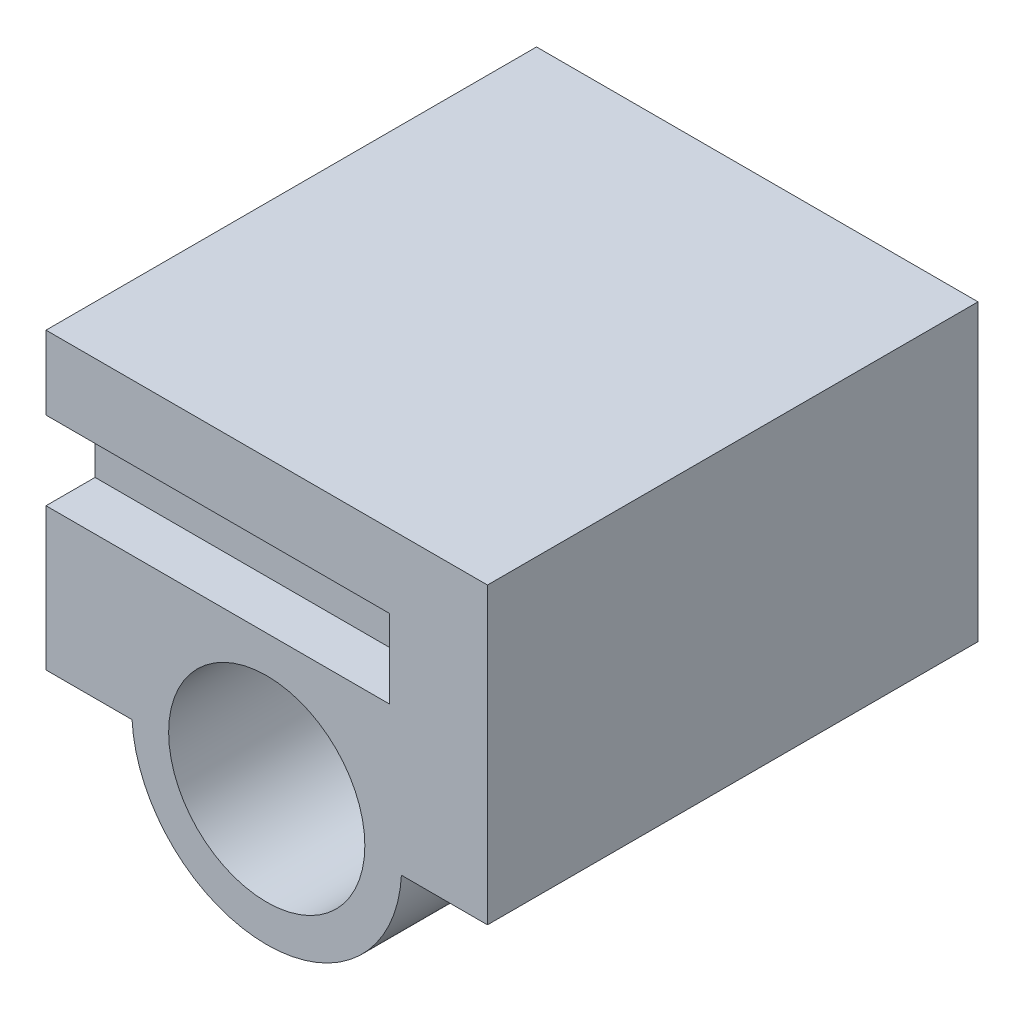
from build123d import *

# Parameters (mm, degrees)
SKETCH1_W           = 9
SKETCH1_H           = 6
BOSS_EXTRUDE1_DEPTH = 10
CUT_EXTRUDE1_START  = -2
SKETCH2_W           = 10
SKETCH2_H           = 1.6
CUT_EXTRUDE1_DEPTH  = 7
SKETCH3_R           = 2.75
BOSS_EXTRUDE2_DEPTH = 10
SKETCH4_R           = 2
CUT_EXTRUDE2_DEPTH  = 7
BOSS_EXTRUDE3_REACH = 16.573


with BuildPart() as part:
    # Sketch1 → Boss-Extrude1 (new body)
    with BuildSketch(Plane.XY):
        Rectangle(SKETCH1_W, SKETCH1_H)
    extrude(amount=BOSS_EXTRUDE1_DEPTH)

    # Sketch2 → Cut-Extrude1 (cut)
    with BuildSketch(Plane(origin=(4.5, 0, 0), x_dir=(0, 0, -1), z_dir=(1, 0, 0)).offset(CUT_EXTRUDE1_START)):
        with Locations((-5, 0.7)):
            Rectangle(SKETCH2_W, SKETCH2_H)
    extrude(amount=-CUT_EXTRUDE1_DEPTH, mode=Mode.SUBTRACT)

    # Sketch3 → Boss-Extrude2 (add, through all)
    with BuildSketch(Plane.XY.offset(10)):
        with Locations((0, -2.85)):
            Circle(SKETCH3_R)
    extrude(amount=-BOSS_EXTRUDE2_DEPTH)

    # Sketch4 → Cut-Extrude2 (cut)
    with BuildSketch(Plane.XY.offset(10)):
        with Locations((0, -2.85)):
            Circle(SKETCH4_R)
    extrude(amount=-CUT_EXTRUDE2_DEPTH, mode=Mode.SUBTRACT)

    # Sketch5 → Boss-Extrude3 (add, up to next)
    with BuildSketch(Plane.ZY.offset(4.5), mode=Mode.PRIVATE) as boss_extrude3_sk1:
        with BuildLine():
            Line((0, -0.1), (1, -0.1))
            Line((1, -0.1), (1, 0.65))
            ThreePointArc((1, 0.65), (0.956066017, 0.756066017), (0.85, 0.8))
            Line((0.85, 0.8), (0.15, 0.8))
            ThreePointArc((0.15, 0.8), (0.043933983, 0.756066017), (0, 0.65))
            Line((0, 0.65), (0, -0.1))
        make_face()
    boss_extrude3_tool1 = extrude(boss_extrude3_sk1.sketch, amount=-BOSS_EXTRUDE3_REACH, mode=Mode.PRIVATE) - part.part
    # Sketch5 → Boss-Extrude3 (add, up to next)
    with BuildSketch(Plane.ZY.offset(4.5), mode=Mode.PRIVATE) as boss_extrude3_sk2:
        with BuildLine():
            Line((2, -0.1), (2, 0.65))
            ThreePointArc((2, 0.65), (2.043933983, 0.756066017), (2.15, 0.8))
            Line((2.15, 0.8), (2.85, 0.8))
            ThreePointArc((2.85, 0.8), (2.956066017, 0.756066017), (3, 0.65))
            Line((3, 0.65), (3, -0.1))
            Line((3, -0.1), (2, -0.1))
        make_face()
    boss_extrude3_tool2 = extrude(boss_extrude3_sk2.sketch, amount=-BOSS_EXTRUDE3_REACH, mode=Mode.PRIVATE) - part.part
    # Sketch5 → Boss-Extrude3 (add, up to next)
    with BuildSketch(Plane.ZY.offset(4.5), mode=Mode.PRIVATE) as boss_extrude3_sk3:
        with BuildLine():
            Line((4, -0.1), (4, 0.65))
            ThreePointArc((4, 0.65), (4.043933983, 0.756066017), (4.15, 0.8))
            Line((4.15, 0.8), (4.85, 0.8))
            ThreePointArc((4.85, 0.8), (4.956066017, 0.756066017), (5, 0.65))
            Line((5, 0.65), (5, -0.1))
            Line((5, -0.1), (4, -0.1))
        make_face()
    boss_extrude3_tool3 = extrude(boss_extrude3_sk3.sketch, amount=-BOSS_EXTRUDE3_REACH, mode=Mode.PRIVATE) - part.part
    # Sketch5 → Boss-Extrude3 (add, up to next)
    with BuildSketch(Plane.ZY.offset(4.5), mode=Mode.PRIVATE) as boss_extrude3_sk4:
        with BuildLine():
            Line((6, -0.1), (6, 0.65))
            ThreePointArc((6, 0.65), (6.043933983, 0.756066017), (6.15, 0.8))
            Line((6.15, 0.8), (6.85, 0.8))
            ThreePointArc((6.85, 0.8), (6.956066017, 0.756066017), (7, 0.65))
            Line((7, 0.65), (7, -0.1))
            Line((7, -0.1), (6, -0.1))
        make_face()
    boss_extrude3_tool4 = extrude(boss_extrude3_sk4.sketch, amount=-BOSS_EXTRUDE3_REACH, mode=Mode.PRIVATE) - part.part
    # Sketch5 → Boss-Extrude3 (add, up to next)
    with BuildSketch(Plane.ZY.offset(4.5), mode=Mode.PRIVATE) as boss_extrude3_sk5:
        with BuildLine():
            Line((8, -0.1), (8, 0.65))
            ThreePointArc((8, 0.65), (8.043933983, 0.756066017), (8.15, 0.8))
            Line((8.15, 0.8), (8.85, 0.8))
            ThreePointArc((8.85, 0.8), (8.956066017, 0.756066017), (9, 0.65))
            Line((9, 0.65), (9, -0.1))
            Line((9, -0.1), (8, -0.1))
        make_face()
    boss_extrude3_tool5 = extrude(boss_extrude3_sk5.sketch, amount=-BOSS_EXTRUDE3_REACH, mode=Mode.PRIVATE) - part.part
    add(boss_extrude3_tool1.solids().sort_by_distance((-4.5, 0.345482, 0.5))[0])
    add(boss_extrude3_tool2.solids().sort_by_distance((-4.5, 0.345482, 2.5))[0])
    add(boss_extrude3_tool3.solids().sort_by_distance((-4.5, 0.345482, 4.5))[0])
    add(boss_extrude3_tool4.solids().sort_by_distance((-4.5, 0.345482, 6.5))[0])
    add(boss_extrude3_tool5.solids().sort_by_distance((-4.5, 0.345482, 8.5))[0])


solid = part.part
